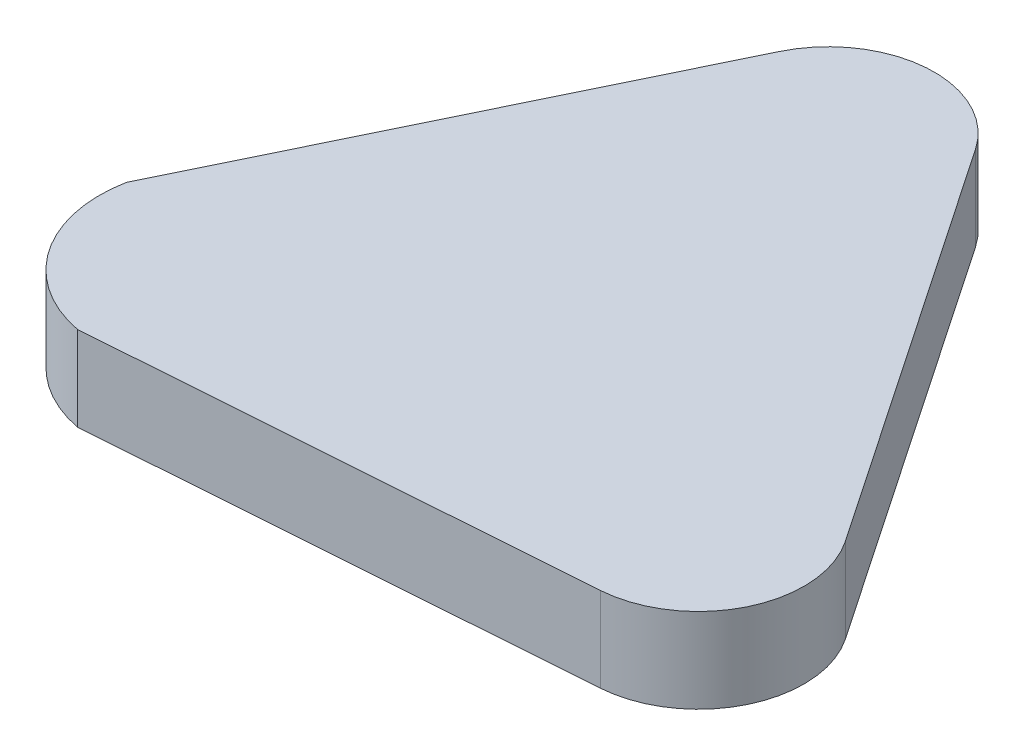
from build123d import *

# Parameters (mm, degrees)
BOSS_EXTRUDE1_DEPTH = 10
BOSS_EXTRUDE2_DEPTH = 10
BOSS_EXTRUDE3_DEPTH = 2


with BuildPart() as part:
    # Sketch1 → Boss-Extrude1 (new body)
    with BuildSketch(Plane.XZ.offset(-112.992351319)):
        with BuildLine():
            Line((-38.224542698, 418.012407464), (30.875674984, 412.996441329))
            ThreePointArc((30.875674984, 412.996441329), (35.013440502, 410.189504116), (34.651444327, 405.202625456))
            Line((34.651444327, 405.202625456), (-4.242618611, 347.868064603))
            ThreePointArc((-4.242618611, 347.868064603), (-8.742380303, 345.688123157), (-12.880145821, 348.49506037))
            Line((-12.880145821, 348.49506037), (-43.086300565, 410.845587357))
            ThreePointArc((-43.086300565, 410.845587357), (-42.724304391, 415.832466017), (-38.224542698, 418.012407464))
        make_face()
    extrude(amount=BOSS_EXTRUDE1_DEPTH)



with BuildPart() as body_2:
    # Sketch3 → Boss-Extrude2 (new body)
    with BuildSketch(Plane.XZ.offset(-102.992351319)):
        with BuildLine():
            Line((4.032912425, 342.254190176), (42.926975363, 399.588751029))
            ThreePointArc((42.926975363, 399.588751029), (44.012963887, 414.549387009), (31.599667334, 422.970198649))
            Line((31.599667334, 422.970198649), (-37.500550349, 427.986164784))
            ThreePointArc((-37.500550349, 427.986164784), (-49.24607828, 420.256643692), (-52.08582395, 406.485704464))
            Line((-52.08582395, 406.485704464), (-21.879669206, 344.135177477))
            ThreePointArc((-21.879669206, 344.135177477), (-9.466372653, 335.714365837), (4.032912425, 342.254190176))
        make_face()
        with BuildLine():
            ThreePointArc((-43.086300565, 410.845587357), (-42.724304391, 415.832466017), (-38.224542698, 418.012407464))
            Line((-38.224542698, 418.012407464), (30.875674984, 412.996441329))
            ThreePointArc((30.875674984, 412.996441329), (35.013440502, 410.189504116), (34.651444327, 405.202625456))
            Line((34.651444327, 405.202625456), (-4.242618611, 347.868064603))
            ThreePointArc((-4.242618611, 347.868064603), (-8.742380303, 345.688123157), (-12.880145821, 348.49506037))
            Line((-12.880145821, 348.49506037), (-43.086300565, 410.845587357))
        make_face(mode=Mode.SUBTRACT)
    extrude(amount=-BOSS_EXTRUDE2_DEPTH)


with BuildPart() as part_1:
    add(part.part)

    add(body_2.part)  # Boss-Extrude3 merges body 2
    # Sketch3<3> → Boss-Extrude3 (add)
    with BuildSketch(Plane.XZ.offset(-102.992351319)):
        with BuildLine():
            Line((4.032912425, 342.254190176), (42.926975363, 399.588751029))
            ThreePointArc((42.926975363, 399.588751029), (44.012963887, 414.549387009), (31.599667334, 422.970198649))
            Line((31.599667334, 422.970198649), (-37.500550349, 427.986164784))
            ThreePointArc((-37.500550349, 427.986164784), (-49.24607828, 420.256643692), (-52.08582395, 406.485704464))
            Line((-52.08582395, 406.485704464), (-21.879669206, 344.135177477))
            ThreePointArc((-21.879669206, 344.135177477), (-9.466372653, 335.714365837), (4.032912425, 342.254190176))
        make_face()
    extrude(amount=BOSS_EXTRUDE3_DEPTH)


solid = part_1.part
